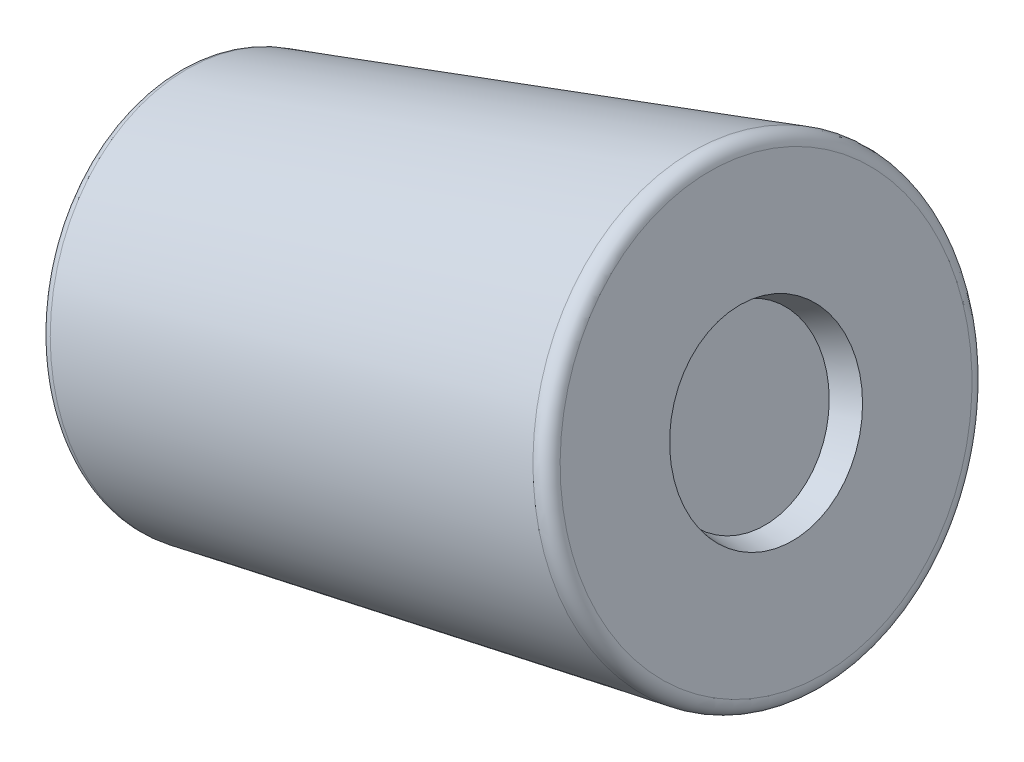
from build123d import *

# Parameters (mm, degrees)
ESQUISSE3_R             = 1.75
ENL_V_MAT_EXTRU_1_DEPTH = 0.5
ENL_V_MAT_EXTRU_1_DRAFT = -16
CONG_1_R                = 0.25


with BuildPart() as part:
    # Esquisse1 → Base-Révolution (revolve)
    with BuildSketch(Plane.XY):
        Polygon((-3.902088534, 19.927376326), (-13.91103216, 16.959557627), (-13.132038717, 13.651290759), (-2.764958297, 16.092414159), align=None)
    revolve(axis=Axis((8.392178994, 23.572831673, 0), (-0.958740541858694, -0.2842825590789876, 0)))


with BuildPart() as enl_v_mat_extru_1_tool:
    # Esquisse3 → Enlèv. mat.-Extru.1 (with draft: the straight prism first)
    with BuildSketch(Plane(origin=(1.8473368, 0.537487696, 0), x_dir=(0, 0, -1), z_dir=(0.958740541858694, 0.2842825590789876, 0))):
        with Locations((0, 20.224333679)):
            Circle(ESQUISSE3_R)
    extrude(amount=-ENL_V_MAT_EXTRU_1_DEPTH)
    # Enlèv. mat.-Extru.1: the draft: its side faces are tilted about the plane it starts from
    enl_v_mat_extru_1_sides = [enl_v_mat_extru_1_tool.faces().sort_by_distance(p)[0] for p in [
        (-4.141773669, 19.856305686, 1.75),
    ]]
    draft(enl_v_mat_extru_1_sides, Plane(origin=(1.8473368, 0.537487696, 0), x_dir=(0, 0, -1), z_dir=(0.958740541858694, 0.2842825590789876, 0)), ENL_V_MAT_EXTRU_1_DRAFT)


with BuildPart() as part_1:
    add(part.part)

    # Enlèv. mat.-Extru.1: cut by enl_v_mat_extru_1_tool
    add(enl_v_mat_extru_1_tool.part, mode=Mode.SUBTRACT)

    # Congé1
    cong_1_edges = [part_1.edges().sort_by_distance(p)[0] for p in [
        (-15.061307419, 20.157733245, 0),
        (-5.03921877, 23.762338494, 0),
    ]]
    fillet(cong_1_edges, radius=CONG_1_R)


solid = part_1.part
